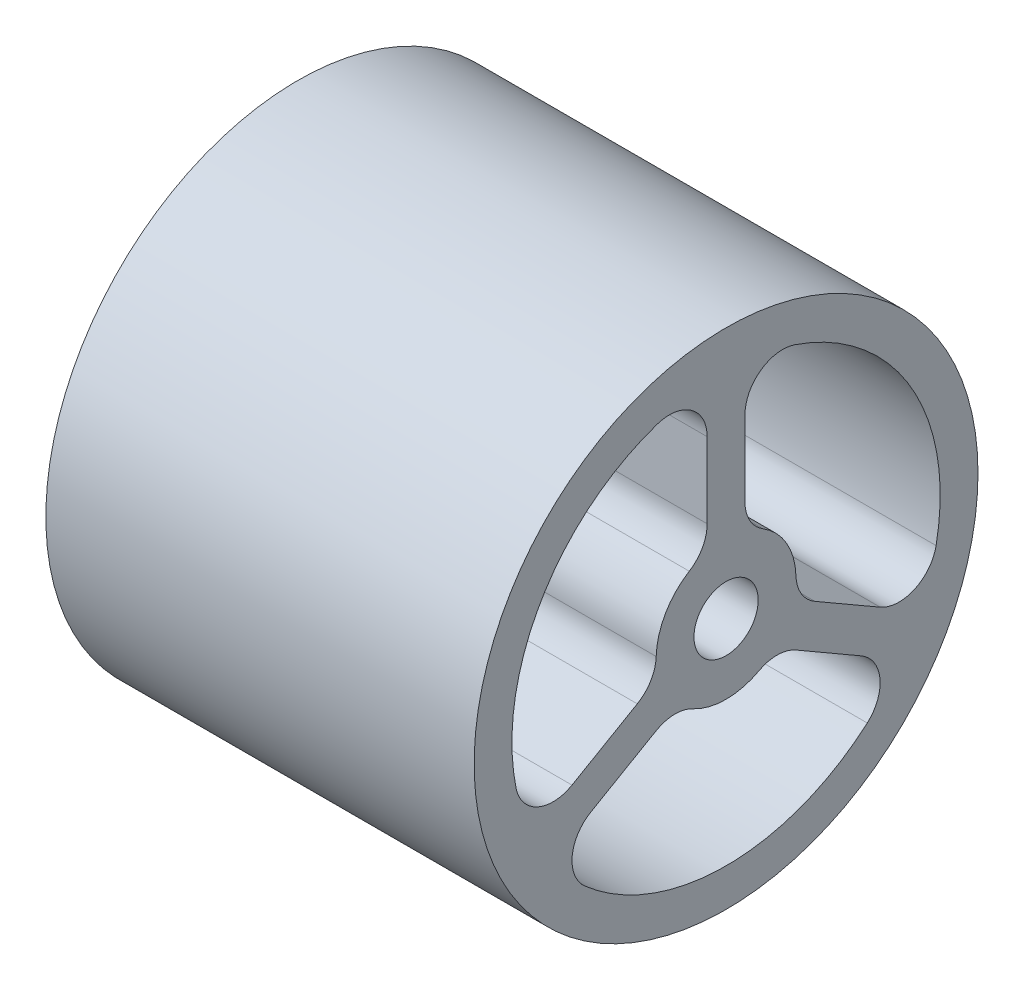
from build123d import *

# Parameters (mm, degrees)
SKETCH1_R           = 20
SKETCH1_R_2         = 2.55
BOSS_EXTRUDE1_DEPTH = 34
FILLET1_R           = 3


with BuildPart() as part:
    # Sketch1 → Boss-Extrude1 (new body)
    # profile 1 of 11: a face of its own
    with BuildSketch(Plane(origin=(0, 0, 0), x_dir=(0, 0, -1), z_dir=(1, 0, 0))):
        Circle(SKETCH1_R)
        with BuildLine():
            ThreePointArc((-15.415009376, -7.167809005), (-14.722431864, 8.5), (-1.5, 16.933694222))
            Line((-1.5, 16.933694222), (-1.5, 17))
            ThreePointArc((-1.5, 17), (0, 18.5), (1.5, 17))
            Line((1.5, 17), (1.5, 16.933694222))
            ThreePointArc((1.5, 16.933694222), (12.539936204, 11.478240283), (17, 0))
            ThreePointArc((17, 0), (16.599023456, -3.670479574), (15.415009376, -7.167809005))
            Line((15.415009376, -7.167809005), (15.472431864, -7.200961894))
            ThreePointArc((15.472431864, -7.200961894), (16.02146997, -9.25), (13.972431864, -9.799038106))
            Line((13.972431864, -9.799038106), (13.915009376, -9.765885217))
            ThreePointArc((13.915009376, -9.765885217), (0, -17), (-13.915009376, -9.765885217))
            Line((-13.915009376, -9.765885217), (-13.972431864, -9.799038106))
            ThreePointArc((-13.972431864, -9.799038106), (-16.02146997, -9.25), (-15.472431864, -7.200961894))
            Line((-15.472431864, -7.200961894), (-15.415009376, -7.167809005))
        make_face(mode=Mode.SUBTRACT)
    # profile 2 of 11: a face of its own
    with BuildSketch(Plane(origin=(0, 0, 0), x_dir=(0, 0, -1), z_dir=(1, 0, 0))):
        with BuildLine():
            ThreePointArc((1.486240766, 5.347297297), (0, 4.05), (-1.486240766, 5.347297297))
            ThreePointArc((-1.486240766, 5.347297297), (-4.806440991, 2.775), (-5.374015684, -1.386526389))
            ThreePointArc((-5.374015684, -1.386526389), (-3.507402885, -2.025), (-3.887774918, -3.960770908))
            ThreePointArc((-3.887774918, -3.960770908), (0, -5.55), (3.887774918, -3.960770908))
            ThreePointArc((3.887774918, -3.960770908), (3.507402885, -2.025), (5.374015684, -1.386526389))
            ThreePointArc((5.374015684, -1.386526389), (5.505828141, -0.698825069), (5.55, 0))
            ThreePointArc((5.55, 0), (4.418774505, 3.358114333), (1.486240766, 5.347297297))
        make_face()
        Circle(SKETCH1_R_2, mode=Mode.SUBTRACT)
    # profile 3 of 11: a face of its own
    with BuildSketch(Plane(origin=(0, 0, 0), x_dir=(0, 0, -1), z_dir=(1, 0, 0))):
        with BuildLine():
            ThreePointArc((-3.887774918, -3.960770908), (-3.507402885, -2.025), (-5.374015684, -1.386526389))
            ThreePointArc((-5.374015684, -1.386526389), (-4.806440991, -2.775), (-3.887774918, -3.960770908))
        make_face()
    # profile 4 of 11: a face of its own
    with BuildSketch(Plane(origin=(0, 0, 0), x_dir=(0, 0, -1), z_dir=(1, 0, 0))):
        with BuildLine():
            ThreePointArc((-13.915009376, -9.765885217), (-14.722431864, -8.5), (-15.415009376, -7.167809005))
            Line((-15.415009376, -7.167809005), (-15.472431864, -7.200961894))
            ThreePointArc((-15.472431864, -7.200961894), (-16.02146997, -9.25), (-13.972431864, -9.799038106))
            Line((-13.972431864, -9.799038106), (-13.915009376, -9.765885217))
        make_face()
    # profile 5 of 11: a face of its own
    with BuildSketch(Plane(origin=(0, 0, 0), x_dir=(0, 0, -1), z_dir=(1, 0, 0))):
        with BuildLine():
            ThreePointArc((3.887774918, -3.960770908), (4.806440991, -2.775), (5.374015684, -1.386526389))
            ThreePointArc((5.374015684, -1.386526389), (3.507402885, -2.025), (3.887774918, -3.960770908))
        make_face()
    # profile 6 of 11: a face of its own
    with BuildSketch(Plane(origin=(0, 0, 0), x_dir=(0, 0, -1), z_dir=(1, 0, 0))):
        with BuildLine():
            ThreePointArc((1.486240766, 5.347297297), (0, 5.55), (-1.486240766, 5.347297297))
            ThreePointArc((-1.486240766, 5.347297297), (0, 4.05), (1.486240766, 5.347297297))
        make_face()
    # profile 7 of 11: a face of its own
    with BuildSketch(Plane(origin=(0, 0, 0), x_dir=(0, 0, -1), z_dir=(1, 0, 0))):
        with BuildLine():
            Line((15.472431864, -7.200961894), (15.415009376, -7.167809005))
            ThreePointArc((15.415009376, -7.167809005), (14.722431864, -8.5), (13.915009376, -9.765885217))
            Line((13.915009376, -9.765885217), (13.972431864, -9.799038106))
            ThreePointArc((13.972431864, -9.799038106), (16.02146997, -9.25), (15.472431864, -7.200961894))
        make_face()
    # profile 8 of 11: a face of its own
    with BuildSketch(Plane(origin=(0, 0, 0), x_dir=(0, 0, -1), z_dir=(1, 0, 0))):
        with BuildLine():
            ThreePointArc((13.915009376, -9.765885217), (14.722431864, -8.5), (15.415009376, -7.167809005))
            Line((15.415009376, -7.167809005), (5.556440991, -1.475961894))
            ThreePointArc((5.556440991, -1.475961894), (5.466744289, -1.428151993), (5.374015684, -1.386526389))
            ThreePointArc((5.374015684, -1.386526389), (4.806440991, -2.775), (3.887774918, -3.960770908))
            ThreePointArc((3.887774918, -3.960770908), (3.970188051, -4.020263434), (4.056440991, -4.074038106))
            Line((4.056440991, -4.074038106), (13.915009376, -9.765885217))
        make_face()
    # profile 9 of 11: a face of its own
    with BuildSketch(Plane(origin=(0, 0, 0), x_dir=(0, 0, -1), z_dir=(1, 0, 0))):
        with BuildLine():
            Line((-5.556440991, -1.475961894), (-15.415009376, -7.167809005))
            ThreePointArc((-15.415009376, -7.167809005), (-14.722431864, -8.5), (-13.915009376, -9.765885217))
            Line((-13.915009376, -9.765885217), (-4.056440991, -4.074038106))
            ThreePointArc((-4.056440991, -4.074038106), (-3.970188051, -4.020263434), (-3.887774918, -3.960770908))
            ThreePointArc((-3.887774918, -3.960770908), (-4.806440991, -2.775), (-5.374015684, -1.386526389))
            ThreePointArc((-5.374015684, -1.386526389), (-5.466744289, -1.428151993), (-5.556440991, -1.475961894))
        make_face()
    # profile 10 of 11: a face of its own
    with BuildSketch(Plane(origin=(0, 0, 0), x_dir=(0, 0, -1), z_dir=(1, 0, 0))):
        with BuildLine():
            Line((-1.5, 16.933694222), (-1.5, 5.55))
            ThreePointArc((-1.5, 5.55), (-1.496556238, 5.448415427), (-1.486240766, 5.347297297))
            ThreePointArc((-1.486240766, 5.347297297), (0, 5.55), (1.486240766, 5.347297297))
            ThreePointArc((1.486240766, 5.347297297), (1.496556238, 5.448415427), (1.5, 5.55))
            Line((1.5, 5.55), (1.5, 16.933694222))
            ThreePointArc((1.5, 16.933694222), (0, 17), (-1.5, 16.933694222))
        make_face()
    # profile 11 of 11: a face of its own
    with BuildSketch(Plane(origin=(0, 0, 0), x_dir=(0, 0, -1), z_dir=(1, 0, 0))):
        with BuildLine():
            Line((-1.5, 17), (-1.5, 16.933694222))
            ThreePointArc((-1.5, 16.933694222), (0, 17), (1.5, 16.933694222))
            Line((1.5, 16.933694222), (1.5, 17))
            ThreePointArc((1.5, 17), (0, 18.5), (-1.5, 17))
        make_face()
    extrude(amount=BOSS_EXTRUDE1_DEPTH)

    # Fillet1
    fillet1_edges = [part.edges().sort_by_distance(p)[0] for p in [
        (17, 16.933694222, -1.5),
        (17, 5.347297297, -1.486240766),
        (17, 5.347297297, 1.486240766),
        (17, -1.386526389, -5.374015684),
        (17, -3.960770908, -3.887774918),
        (17, -7.167809005, -15.415009376),
        (17, -3.960770908, 3.887774918),
        (17, -1.386526389, 5.374015684),
        (17, -9.765885217, 13.915009376),
        (17, -9.765885217, -13.915009376),
        (17, 16.933694222, 1.5),
        (17, -7.167809005, 15.415009376),
    ]]
    fillet(fillet1_edges, radius=FILLET1_R)


solid = part.part
